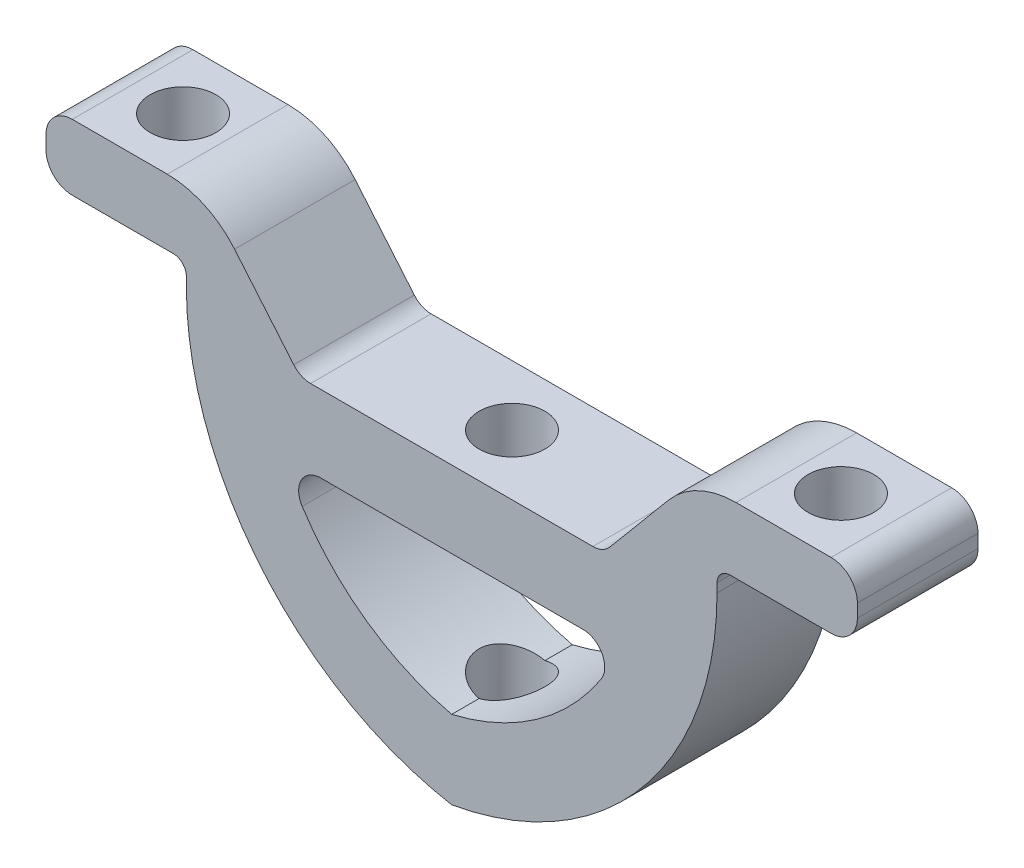
from build123d import *

# Parameters (mm, degrees)
BOSS_EXTRUDE1_DEPTH     = 1.375
CUT_EXTRUDE1_DEPTH      = 14.125518547
CUT_EXTRUDE1_DEPTH_BACK = 14.125518547
SKETCH2_R               = 0.75


with BuildPart() as part:
    # Sketch1 → Boss-Extrude1 (new, symmetric)
    with BuildSketch(Plane.XY):
        with BuildLine():
            Line((-8.65, 0), (-6.482615316, 0))
            ThreePointArc((-6.482615316, 0), (-5.637378793, -0.187384426), (-4.95052643, -0.714424781))
            Line((-4.95052643, -0.714424781), (-3.602119315, -2.321393805))
            ThreePointArc((-3.602119315, -2.321393805), (-3.430406224, -2.453153894), (-3.219097093, -2.5))
            Line((-3.219097093, -2.5), (3.219097093, -2.5))
            ThreePointArc((3.219097093, -2.5), (3.430406224, -2.453153894), (3.602119315, -2.321393805))
            Line((3.602119315, -2.321393805), (4.95052643, -0.714424781))
            ThreePointArc((4.95052643, -0.714424781), (5.637378793, -0.187384426), (6.482615316, 0))
            Line((6.482615316, 0), (8.65, 0))
            ThreePointArc((8.65, 0), (9.074264069, -0.175735931), (9.25, -0.6))
            Line((9.25, -0.6), (9.25, -0.9))
            ThreePointArc((9.25, -0.9), (9.074264069, -1.324264069), (8.65, -1.5))
            Line((8.65, -1.5), (6.35, -1.5))
            ThreePointArc((6.35, -1.5), (6.137867966, -1.587867966), (6.05, -1.8))
            Line((6.05, -1.8), (6.05, -2))
            ThreePointArc((6.05, -2), (4.337132574, -6.706064576), (0, -9.210109235))
            ThreePointArc((0, -9.210109235), (-4.337132574, -6.706064576), (-6.05, -2))
            Line((-6.05, -2), (-6.05, -1.8))
            ThreePointArc((-6.05, -1.8), (-6.137867966, -1.587867966), (-6.35, -1.5))
            Line((-6.35, -1.5), (-8.65, -1.5))
            ThreePointArc((-8.65, -1.5), (-9.074264069, -1.324264069), (-9.25, -0.9))
            Line((-9.25, -0.9), (-9.25, -0.6))
            ThreePointArc((-9.25, -0.6), (-9.074264069, -0.175735931), (-8.65, 0))
        make_face()
        with BuildLine():
            Line((2.989643947, -4.25), (-2.989643947, -4.25))
            ThreePointArc((-2.989643947, -4.25), (-3.428714462, -4.510799074), (-3.409748242, -5.021131667))
            ThreePointArc((-3.409748242, -5.021131667), (-1.938287409, -6.553911081), (0, -7.424342947))
            ThreePointArc((0, -7.424342947), (1.938287409, -6.553911081), (3.409748242, -5.021131667))
            ThreePointArc((3.409748242, -5.021131667), (3.428714462, -4.510799074), (2.989643947, -4.25))
        make_face(mode=Mode.SUBTRACT)
    extrude(amount=BOSS_EXTRUDE1_DEPTH, both=True)

    # Sketch2 → Cut-Extrude1 (cut, two sides: drawn at the far end of the back side and taken through both)
    with BuildSketch(Plane(origin=(0, 0, 0), x_dir=(1, 0, 0), z_dir=(0, 1, 0)).offset(-CUT_EXTRUDE1_DEPTH_BACK)):
        with Locations(Location((0, 0, 0), (0, 0, 270))):
            Circle(SKETCH2_R)
        with Locations(Location((-7.5, 0, 0), (0, 0, 180))):
            Circle(SKETCH2_R)
        with Locations((7.5, 0)):
            Circle(SKETCH2_R)
    extrude(amount=CUT_EXTRUDE1_DEPTH + CUT_EXTRUDE1_DEPTH_BACK, mode=Mode.SUBTRACT)


solid = part.part
